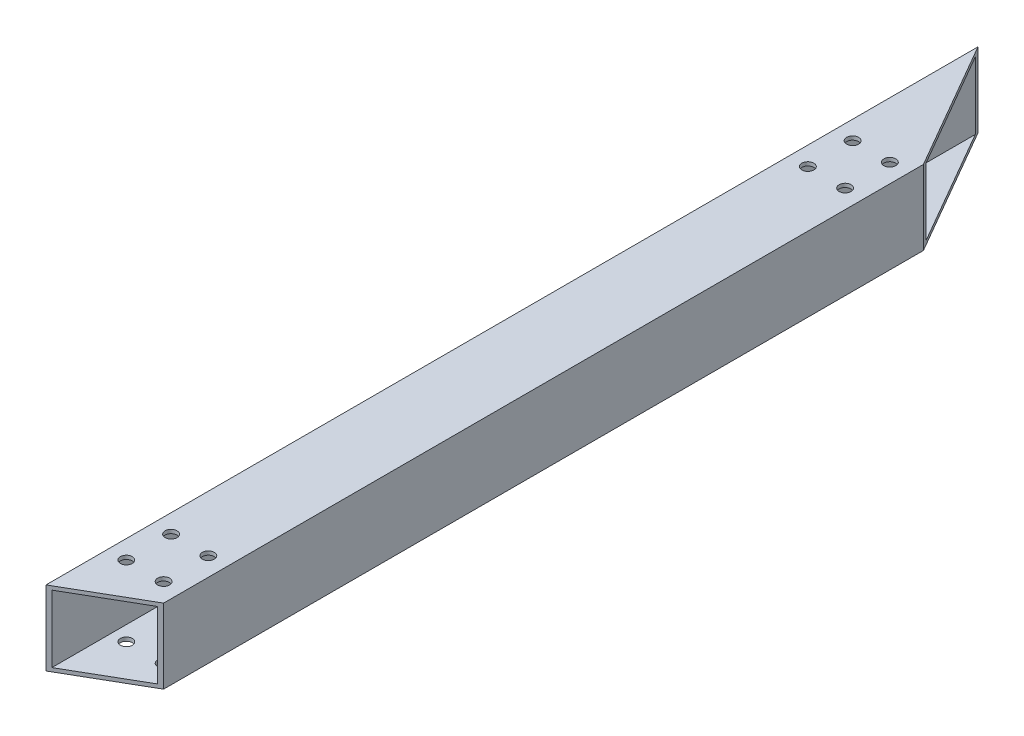
from build123d import *

# Parameters (mm, degrees)
SKETCH_1_W          = 20
SKETCH_1_H          = 20
SKETCH_1_W_2        = 18
SKETCH_1_H_2        = 18
EXTRUDE_1_DEPTH     = 250
CUT_EXTRUDE_1_DEPTH = 120
SKETCH_3_R          = 1.6
CUT_EXTRUDE_2_DEPTH = 252.594912508


with BuildPart() as part:
    # 草图1 → 凸台-拉伸1 (new body)
    with BuildSketch(Plane.XY):
        with Locations((10, 10)):
            Rectangle(SKETCH_1_W, SKETCH_1_H)
        with Locations((10, 10)):
            Rectangle(SKETCH_1_W_2, SKETCH_1_H_2, mode=Mode.SUBTRACT)
    extrude(amount=EXTRUDE_1_DEPTH)

    # 草图2 → 切除-拉伸1 (cut)
    with BuildSketch(Plane(origin=(0, 20, 0), x_dir=(1, 0, 0), z_dir=(0, 1, 0))):
        Polygon((0, 0), (20, 0), (20, -34.641016151), align=None)
        Polygon((0, -250), (20, -238.452994616), (20, -250), align=None)
    extrude(amount=-CUT_EXTRUDE_1_DEPTH, mode=Mode.SUBTRACT)

    # 草图3 → 切除-拉伸2 (cut, through all)
    with BuildSketch(Plane.XZ):
        with Locations((5, 233.452994616)):
            Circle(SKETCH_3_R)
        with Locations((15, 233.452994616)):
            Circle(SKETCH_3_R)
        with Locations((15, 221.452994616)):
            Circle(SKETCH_3_R)
        with Locations((5, 221.452994616)):
            Circle(SKETCH_3_R)
        with Locations((15, 38.641016151)):
            Circle(SKETCH_3_R)
        with Locations((5, 38.641016151)):
            Circle(SKETCH_3_R)
        with Locations((15, 50.641016151)):
            Circle(SKETCH_3_R)
        with Locations((5, 50.641016151)):
            Circle(SKETCH_3_R)
    extrude(amount=-CUT_EXTRUDE_2_DEPTH, mode=Mode.SUBTRACT)


solid = part.part
